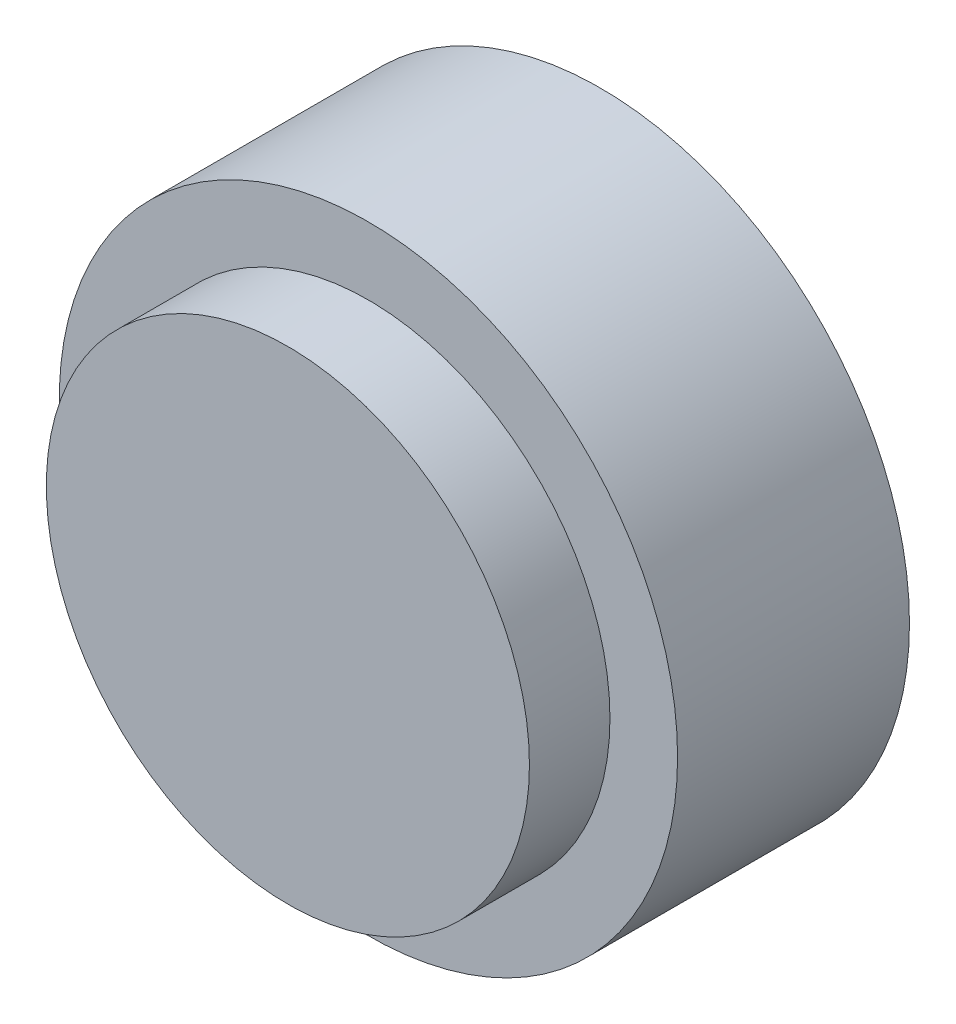
from build123d import *

# Parameters (mm, degrees)
SKETCH1_R                   = 37.5
BOSS_EXTRUDE1_DEPTH         = 12.5
SKETCH1_3_R                 = 48
SKETCH1_3_R_2               = 21
BOSS_EXTRUDE2_DEPTH         = 36
M4_TAPPED_HOLE1_D           = 3.3
M4_TAPPED_HOLE1_DEPTH       = 8
M4_TAPPED_HOLE1_CSINK_D     = 4.05
M4_TAPPED_HOLE1_CSINK_ANGLE = 90
M4_TAPPED_HOLE1_TIP         = 0.991420021


with BuildPart() as part:
    # Sketch1 → Boss-Extrude1 (new body)
    with BuildSketch(Plane.XY):
        Circle(SKETCH1_R)
    extrude(amount=BOSS_EXTRUDE1_DEPTH)

    # Sketch1<3> → Boss-Extrude2 (add)
    with BuildSketch(Plane.XY):
        Circle(SKETCH1_3_R)
        Circle(SKETCH1_3_R_2, mode=Mode.SUBTRACT)
    extrude(amount=-BOSS_EXTRUDE2_DEPTH)

    # M4 Tapped Hole1
    with Locations(Plane(origin=(0, 0, -36), x_dir=(-1, 0, 0), z_dir=(0, 0, -1))):
        with Locations((0, 42), (29.69848481, 29.69848481), (42, 0), (29.69848481, -29.69848481), (0, -42), (-29.69848481, -29.69848481), (-42, 0), (-29.69848481, 29.69848481)):
            CounterSinkHole(M4_TAPPED_HOLE1_D / 2, M4_TAPPED_HOLE1_CSINK_D / 2, depth=M4_TAPPED_HOLE1_DEPTH, counter_sink_angle=M4_TAPPED_HOLE1_CSINK_ANGLE)
            with Locations((0, 0, -(M4_TAPPED_HOLE1_DEPTH + M4_TAPPED_HOLE1_TIP / 2))):  # 118° drill point
                Cone(0, M4_TAPPED_HOLE1_D / 2, M4_TAPPED_HOLE1_TIP, mode=Mode.SUBTRACT)


solid = part.part
